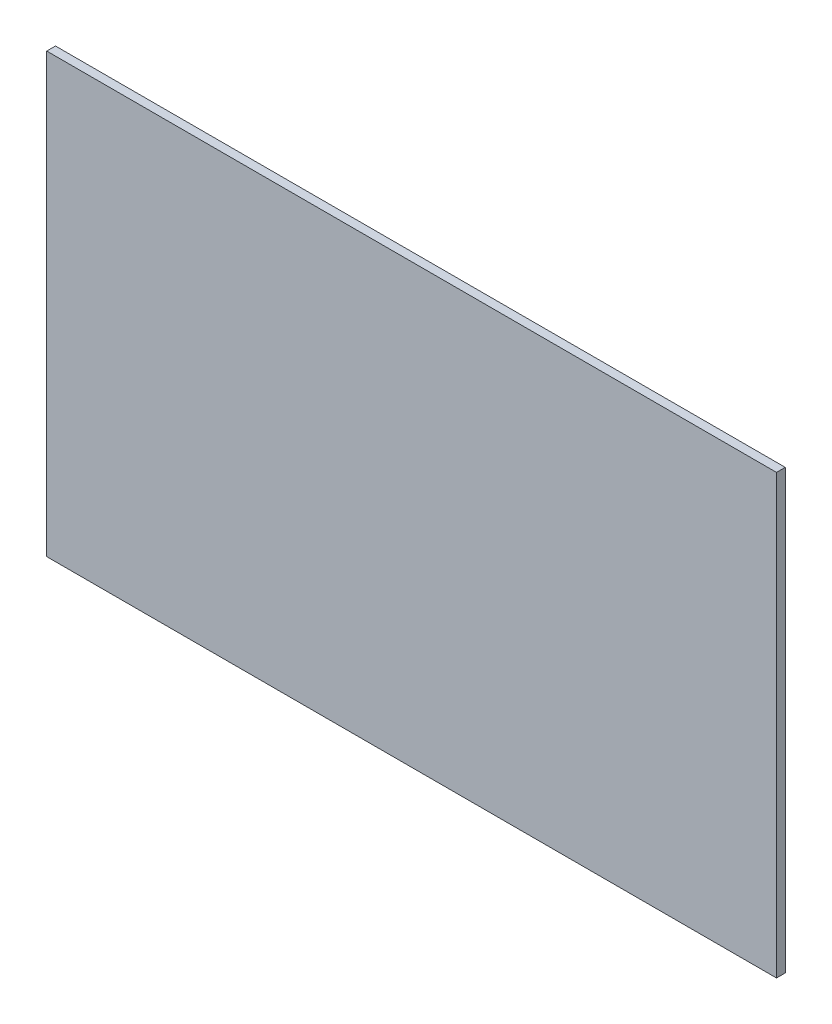
from build123d import *

# Parameters (mm, degrees)
SKETCH1_W           = 250
SKETCH1_H           = 150
BOSS_EXTRUDE1_DEPTH = 3


with BuildPart() as part:
    # Sketch1 → Boss-Extrude1 (new body)
    with BuildSketch(Plane.XY):
        with Locations((0, 2.063106796)):
            Rectangle(SKETCH1_W, SKETCH1_H)
    extrude(amount=BOSS_EXTRUDE1_DEPTH)


solid = part.part
